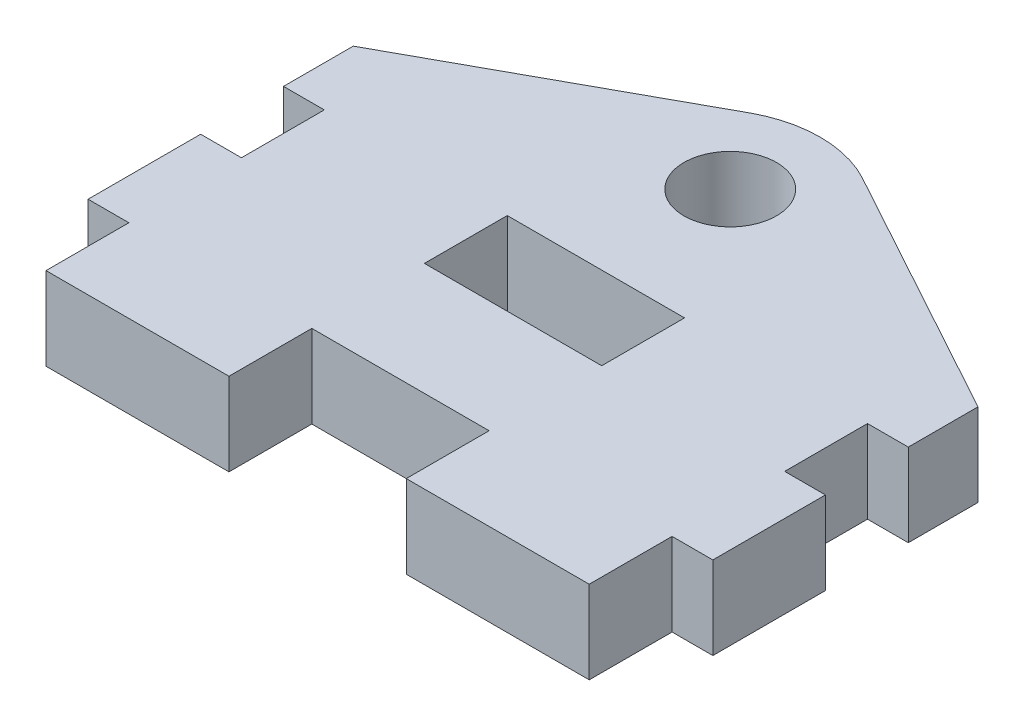
from build123d import *

# Parameters (mm, degrees)
SKETCH1_W                = 12.5
SKETCH1_H                = 5.842
BOSS_EXTRUDE2_DEPTH      = 5.842
F_0_257_DIAMETER_HOLE1_D = 6.5278
SKETCH4_W                = 3.175
SKETCH4_H                = 7.9375
SKETCH4_H_2              = 6.35
CUT_EXTRUDE1_DEPTH       = 60.084754764


with BuildPart() as part:
    # Sketch1 → Boss-Extrude2 (new body)
    with BuildSketch(Plane(origin=(0, 0, 0), x_dir=(1, 0, 0), z_dir=(0, 1, 0))):
        with BuildLine():
            Line((0, 0), (-6.45, 0))
            Line((-6.45, 0), (-6.45, -5.842))
            Line((-6.45, -5.842), (-19.35, -5.842))
            Line((-19.35, -5.842), (-19.35, 0))
            Line((-19.35, 0), (-31.85, 0))
            Line((-31.85, 0), (-31.85, -5.842))
            Line((-31.85, -5.842), (-44.75, -5.842))
            Line((-44.75, -5.842), (-44.75, 0))
            Line((-44.75, 0), (-50.8, 0))
            Line((-50.8, 0), (-50.8, 7.9375))
            Line((-50.8, 7.9375), (-44.75, 7.9375))
            Line((-44.75, 7.9375), (-44.75, 13.7795))
            Line((-44.75, 13.7795), (-50.8, 13.7795))
            Line((-50.8, 13.7795), (-50.8, 16.9545))
            Line((-50.8, 16.9545), (-29.597574108, 28.577494936))
            ThreePointArc((-29.597574108, 28.577494936), (-25.6, 29.601339184), (-21.602425892, 28.577494936))
            Line((-21.602425892, 28.577494936), (-0.4, 16.9545))
            Line((-0.4, 16.9545), (-0.4, 13.7795))
            Line((-0.4, 13.7795), (-6.45, 13.7795))
            Line((-6.45, 13.7795), (-6.45, 7.9375))
            Line((-6.45, 7.9375), (0, 7.9375))
            Line((0, 7.9375), (0, 0))
        make_face()
        with Locations((-25.6, 10.8585)):
            Rectangle(SKETCH1_W, SKETCH1_H, mode=Mode.SUBTRACT)
    extrude(amount=BOSS_EXTRUDE2_DEPTH)

    # F (0.257) Diameter Hole1 (through all)
    with Locations(Plane(origin=(0, 5.842, 0), x_dir=(1, 0, 0), z_dir=(0, 1, 0))):
        with Locations((-25.6, 23.251339184)):
            Hole(F_0_257_DIAMETER_HOLE1_D / 2)

    # Sketch4 → Cut-Extrude1 (cut, through all)
    with BuildSketch(Plane(origin=(0, 5.842, 0), x_dir=(1, 0, 0), z_dir=(0, 1, 0))):
        with Locations((-49.2125, 3.96875)):
            Rectangle(SKETCH4_W, SKETCH4_H)
        Polygon((-3.575, 7.9375), (-3.575, 0), (-0.4, 0), (0, 0), (0, 7.9375), (-0.4, 7.9375), align=None)
        with Locations((-49.2125, 16.9545)):
            Rectangle(SKETCH4_W, SKETCH4_H_2)
        with Locations((-1.9875, 16.9545)):
            Rectangle(SKETCH4_W, SKETCH4_H_2)
    extrude(amount=-CUT_EXTRUDE1_DEPTH, mode=Mode.SUBTRACT)


solid = part.part
